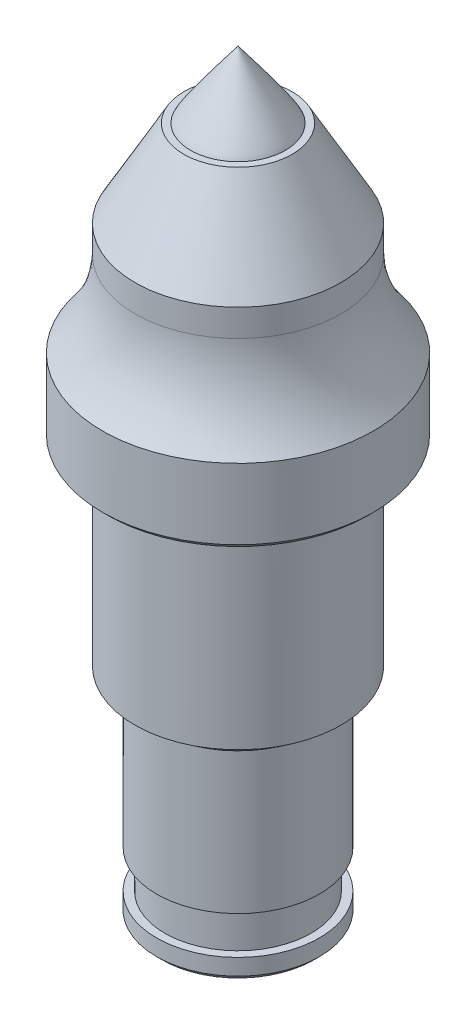
from build123d import *

# Parameters (mm, degrees)
CHANFREIN1_SIZE = 1
CONG_1_R        = 2
CHANFREIN2_SIZE = 1


with BuildPart() as part:
    # Esquisse1 → Révolution1 (revolve)
    with BuildSketch(Plane.XY):
        with BuildLine():
            Line((0, -73.055180274), (-15, -73.055180274))
            Line((-15, -73.055180274), (-15, -69.055180274))
            Line((-15, -69.055180274), (-13.5, -69.055180274))
            Line((-13.5, -69.055180274), (-13.5, -62.055180274))
            Line((-13.5, -62.055180274), (-15, -62.055180274))
            Line((-15, -62.055180274), (-15, -36.055180274))
            Line((-15, -36.055180274), (-19, -33.055180274))
            Line((-19, -33.055180274), (-19, 2.944819726))
            Line((-19, 2.944819726), (-25, 2.944819726))
            Line((-25, 2.944819726), (-25, 16.944819726))
            add(Edge.make_bspline(
                [(-25, 16.944819726), (-19.244550807, 23.982210742), (-19, 32.642645103)],
                knots=[0, 0, 0, 1, 1, 1], degree=2))
            Line((-19, 32.642645103), (-19, 37.642645103))
            Line((-19, 37.642645103), (-10, 53.642645103))
            Line((-10, 53.642645103), (-8.75, 53.642645103))
            add(Edge.make_bspline(
                [(-8.75, 53.642645103), (-8.046565442, 55.307116929), (0, 65.944819726)],
                knots=[0, 0, 0, 1, 1, 1], degree=2))
            Line((0, 65.944819726), (0, -73.055180274))
        make_face()
    revolve(axis=Axis((0, 65.944819726, 0), (0, -1, 0)))

    # Chanfrein1
    chanfrein1_edges = [part.edges().sort_by_distance(p)[0] for p in [
        (25, 2.944819726, 0),
    ]]
    chamfer(chanfrein1_edges, length=CHANFREIN1_SIZE)

    # Congé1
    cong_1_edges = [part.edges().sort_by_distance(p)[0] for p in [
        (19, 2.944819726, 0),
    ]]
    fillet(cong_1_edges, radius=CONG_1_R)

    # Chanfrein2
    chanfrein2_edges = [part.edges().sort_by_distance(p)[0] for p in [
        (15, -73.055180274, 0),
    ]]
    chamfer(chanfrein2_edges, length=CHANFREIN2_SIZE)


solid = part.part
